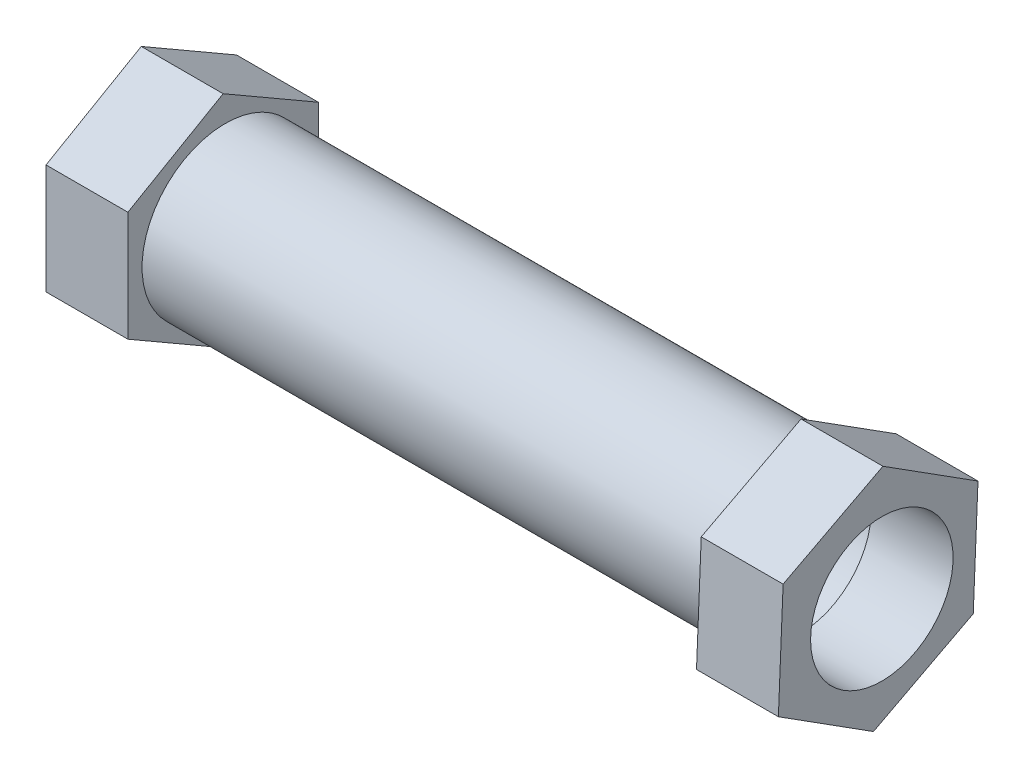
from build123d import *

# Parameters (mm, degrees)
SKETCH1_R            = 50.800375113
SKETCH1_R_2          = 47.812951641
BOSS_EXTRUDE2_DEPTH  = 350
BOSS_EXTRUDE5_DEPTH  = 50
BOSS_EXTRUDE11_DEPTH = 50
SKETCH6_R            = 44.996318031
CUT_EXTRUDE2_DEPTH   = 50
SKETCH7_R            = 43.517898498
CUT_EXTRUDE3_DEPTH   = 50


with BuildPart() as part:
    # Sketch1 → Boss-Extrude2 (new body)
    with BuildSketch(Plane(origin=(0, 0, 0), x_dir=(0, 0, -1), z_dir=(1, 0, 0))):
        with Locations((1.289702318, 0)):
            Circle(SKETCH1_R)
        with Locations((1.289702318, 0)):
            Circle(SKETCH1_R_2, mode=Mode.SUBTRACT)
    extrude(amount=BOSS_EXTRUDE2_DEPTH)

    # Sketch3 → Boss-Extrude5 (add)
    with BuildSketch(Plane(origin=(350, 0, 0), x_dir=(0, 0, -1), z_dir=(1, 0, 0))):
        Polygon((58.055626726, -36.855405481), (60.945530776, 31.849944836), (2.88990405, 68.705350317), (-58.055626726, 36.855405481), (-60.945530776, -31.849944836), (-2.88990405, -68.705350317), align=None)
        Polygon((29.411876605, -18.99044871), (30.315925302, 11.383738416), (4.46313198, 27.353761118), (-22.293710039, 12.949596693), (-23.197758737, -17.424590433), (2.655034585, -33.394613135), align=None, mode=Mode.SUBTRACT)
    extrude(amount=BOSS_EXTRUDE5_DEPTH)

    # Sketch5 → Boss-Extrude11 (add)
    with BuildSketch(Plane.ZY):
        Polygon((0, -67.161353017), (58.163437865, -33.580676508), (58.163437865, 33.580676508), (0, 67.161353017), (-58.163437865, 33.580676508), (-58.163437865, -33.580676508), align=None)
    extrude(amount=BOSS_EXTRUDE11_DEPTH)

    # Sketch6 → Cut-Extrude2 (cut)
    with BuildSketch(Plane(origin=(0, 0, 0), x_dir=(0, 0, -1), z_dir=(1, 0, 0))):
        with Locations((2.167278034, 0)):
            Circle(SKETCH6_R)
    extrude(amount=-CUT_EXTRUDE2_DEPTH, mode=Mode.SUBTRACT)

    # Sketch7 → Cut-Extrude3 (cut)
    with BuildSketch(Plane.ZY.offset(-350)):
        with Locations((-2.231478452, -1.09442532)):
            Circle(SKETCH7_R)
    extrude(amount=-CUT_EXTRUDE3_DEPTH, mode=Mode.SUBTRACT)


solid = part.part
